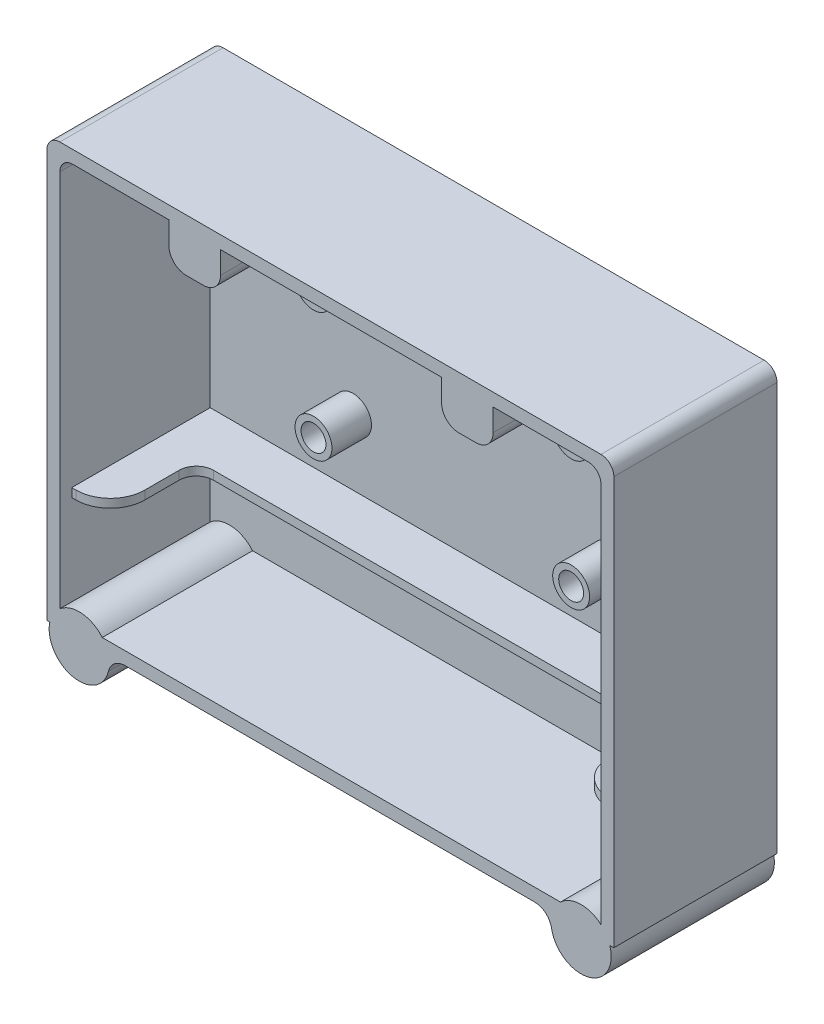
from build123d import *

# Parameters (mm, degrees)
SKETCH1_W           = 66
SKETCH1_H           = 49
BOSS_EXTRUDE1_DEPTH = 19
SHELL1_T            = -1.5
SKETCH2_W           = 6
SKETCH2_H           = 4.6
BOSS_EXTRUDE2_DEPTH = 17.5
FILLET1_R           = 1.5
SKETCH3_R           = 2.15
SKETCH3_R_2         = 1.45
BOSS_EXTRUDE3_DEPTH = 4.6
BOSS_EXTRUDE4_DEPTH = 0.5
FILLET2_R           = 4
FILLET3_R           = 2
BOSS_EXTRUDE5_REACH = 351.368
SKETCH5_R           = 3.5
FILLET4_R           = 2


with BuildPart() as part:
    # Sketch1 → Boss-Extrude1 (new body)
    with BuildSketch(Plane.XY.offset(30)):
        with Locations((105.809562907, 295.544660887)):
            Rectangle(SKETCH1_W, SKETCH1_H)
    extrude(amount=BOSS_EXTRUDE1_DEPTH)

    # Shell1
    shell1_openings = [part.faces().sort_by_distance(p)[0] for p in [
        (105.809562907, 295.544660887, 49),
    ]]
    offset(amount=SHELL1_T, openings=shell1_openings, kind=Kind.INTERSECTION)

    # Sketch2 → Boss-Extrude2 (add)
    with BuildSketch(Plane.XY.offset(31.5)):
        with Locations((90.011318394, 316.244660887)):
            Rectangle(SKETCH2_W, SKETCH2_H)
        with Locations((121.756668801, 316.244660887)):
            Rectangle(SKETCH2_W, SKETCH2_H)
    extrude(amount=BOSS_EXTRUDE2_DEPTH)

    # Fillet1
    fillet1_edges = [part.edges().sort_by_distance(p)[0] for p in [
        (74.309562907, 318.544660887, 40.25),
        (137.309562907, 318.544660887, 40.25),
        (72.809562907, 320.044660887, 39.5),
        (138.809562907, 320.044660887, 39.5),
    ]]
    fillet(fillet1_edges, radius=FILLET1_R)

    # Sketch3 → Boss-Extrude3 (add)
    # profile 1 of 4: a face of its own
    with BuildSketch(Plane.XY.offset(31.5)):
        with Locations((90.939840403, 307.111410879)):
            Circle(SKETCH3_R)
        with Locations((90.939840403, 307.111410879)):
            Circle(SKETCH3_R_2, mode=Mode.SUBTRACT)
    # profile 2 of 4: a face of its own
    with BuildSketch(Plane.XY.offset(31.5)):
        with Locations((120.939840403, 307.111410879)):
            Circle(SKETCH3_R)
        with Locations((120.939840403, 307.111410879)):
            Circle(SKETCH3_R_2, mode=Mode.SUBTRACT)
    # profile 3 of 4: a face of its own
    with BuildSketch(Plane.XY.offset(31.5)):
        with Locations((120.939840403, 292.111410879)):
            Circle(SKETCH3_R)
        with Locations((120.939840403, 292.111410879)):
            Circle(SKETCH3_R_2, mode=Mode.SUBTRACT)
    # profile 4 of 4: a face of its own
    with BuildSketch(Plane.XY.offset(31.5)):
        with Locations((90.939840403, 292.111410879)):
            Circle(SKETCH3_R)
        with Locations((90.939840403, 292.111410879)):
            Circle(SKETCH3_R_2, mode=Mode.SUBTRACT)
    extrude(amount=BOSS_EXTRUDE3_DEPTH)

    # Sketch4 → Boss-Extrude4 (add, symmetric)
    with BuildSketch(Plane(origin=(0, 284, 0), x_dir=(1, 0, 0), z_dir=(0, 1, 0))):
        Polygon((72.809562907, -47.615589413), (78.809562907, -47.615589413), (78.809562907, -37.615589413), (132.809562907, -37.615589413), (132.809562907, -47.615589413), (138.809562907, -47.615589413), (138.809562907, -30), (72.809562907, -30), align=None)
    extrude(amount=BOSS_EXTRUDE4_DEPTH, both=True)

    # Fillet2
    fillet2_edges = [part.edges().sort_by_distance(p)[0] for p in [
        (78.809562907, 284, 47.615589413),
        (132.809562907, 284, 47.615589413),
    ]]
    fillet(fillet2_edges, radius=FILLET2_R)

    # Fillet3
    fillet3_edges = [part.edges().sort_by_distance(p)[0] for p in [
        (78.809562907, 284, 37.615589413),
        (132.809562907, 284, 37.615589413),
    ]]
    fillet(fillet3_edges, radius=FILLET3_R)

    # Boss-Extrude5: up to this face of the body (flat: up to its plane)
    boss_extrude5_end = Plane(part.part.faces().sort_by_distance((105.809562907, 295.537442811, 30))[0])
    # Sketch5 → Boss-Extrude5 (add, up to the picked face)
    with BuildSketch(Plane.XY.offset(49), mode=Mode.PRIVATE) as boss_extrude5_sk1:
        with Locations((76.56102911, 270.299359986)):
            Circle(SKETCH5_R)
    boss_extrude5_tool1 = split(extrude(boss_extrude5_sk1.sketch, amount=-BOSS_EXTRUDE5_REACH, mode=Mode.PRIVATE), bisect_by=boss_extrude5_end, keep=Keep.BOTH, mode=Mode.PRIVATE)
    # Sketch5 → Boss-Extrude5 (add, up to the picked face)
    with BuildSketch(Plane.XY.offset(49), mode=Mode.PRIVATE) as boss_extrude5_sk2:
        with Locations((135, 270)):
            Circle(SKETCH5_R)
    boss_extrude5_tool2 = split(extrude(boss_extrude5_sk2.sketch, amount=-BOSS_EXTRUDE5_REACH, mode=Mode.PRIVATE), bisect_by=boss_extrude5_end, keep=Keep.BOTH, mode=Mode.PRIVATE)
    add(boss_extrude5_tool1.solids().sort_by(Axis((76.561029, 270.29936, 49), (0, 0, -1)))[0])
    add(boss_extrude5_tool2.solids().sort_by(Axis((135, 270, 49), (0, 0, -1)))[0])

    # Fillet4
    fillet4_edges = [part.edges().sort_by_distance(p)[0] for p in [
        (79.980755206, 271.044660887, 39.5),
        (131.659538411, 271.044660887, 39.5),
        (87.011318394, 313.944660887, 40.25),
        (93.011318394, 313.944660887, 40.25),
        (118.756668801, 313.944660887, 40.25),
        (124.756668801, 313.944660887, 40.25),
    ]]
    fillet(fillet4_edges, radius=FILLET4_R)


solid = part.part
